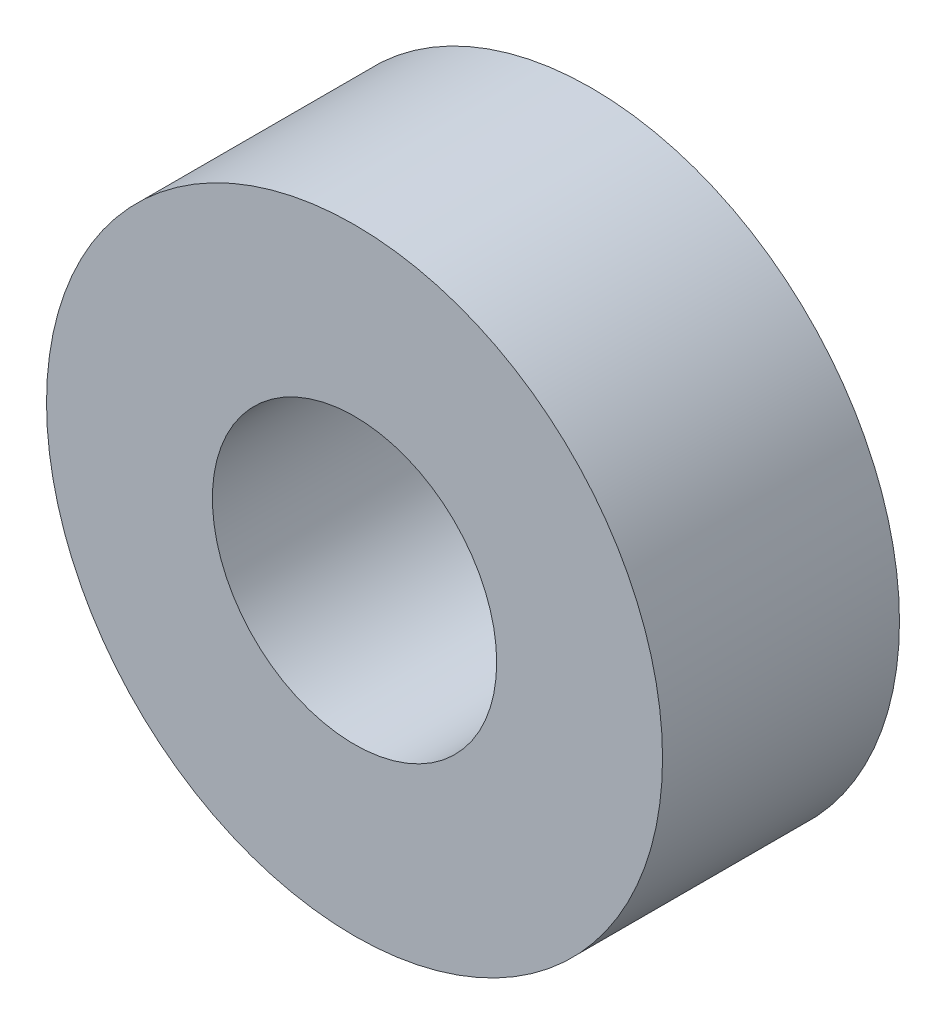
from build123d import *

# Parameters (mm, degrees)
SKETCH1_R           = 6.5
SKETCH1_R_2         = 3
BOSS_EXTRUDE1_DEPTH = 5


with BuildPart() as part:
    # Sketch1 → Boss-Extrude1 (new body)
    with BuildSketch(Plane.XY):
        with Locations((-62, 0)):
            Circle(SKETCH1_R)
        with Locations((-62, 0)):
            Circle(SKETCH1_R_2, mode=Mode.SUBTRACT)
    extrude(amount=-BOSS_EXTRUDE1_DEPTH)


solid = part.part
